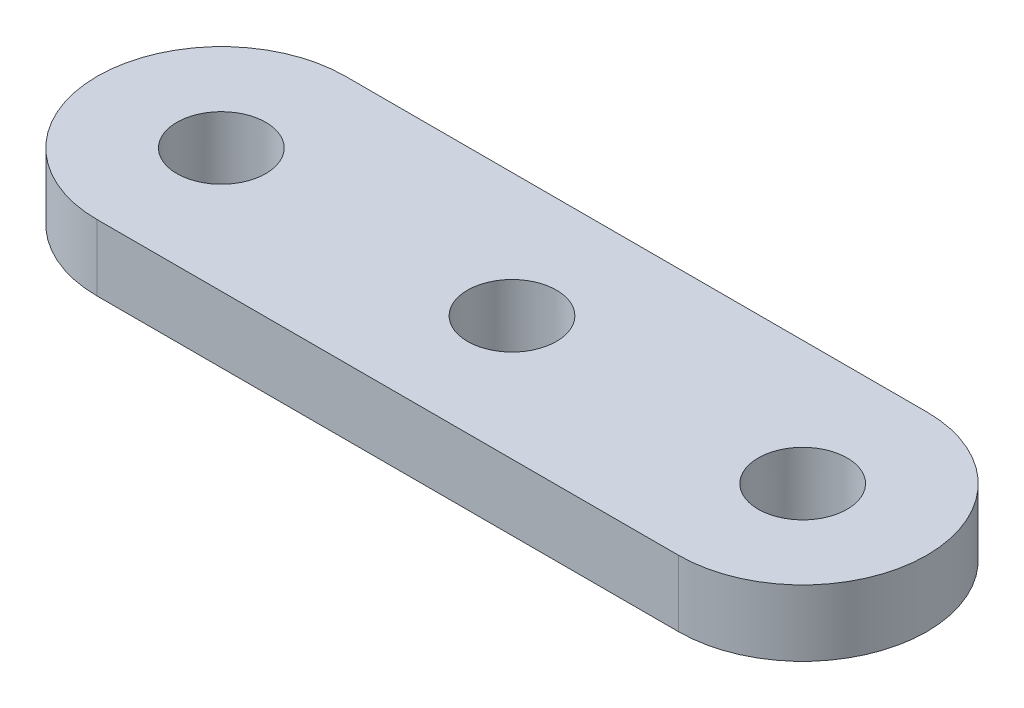
from build123d import *

# Parameters (mm, degrees)
BOSS_EXTRUDE2_DEPTH  = 3.2
M4_CLEARANCE_HOLE4_D = 4.3


with BuildPart() as part:
    # Sketch3 → Boss-Extrude2 (new body)
    with BuildSketch(Plane(origin=(0, 0, 0), x_dir=(1, 0, 0), z_dir=(0, 1, 0))):
        with BuildLine():
            Line((-14.05, 6), (14.05, 6))
            ThreePointArc((14.05, 6), (20.05, 0), (14.05, -6))
            Line((14.05, -6), (-14.05, -6))
            ThreePointArc((-14.05, -6), (-20.05, 0), (-14.05, 6))
        make_face()
    extrude(amount=BOSS_EXTRUDE2_DEPTH)

    # M4 Clearance Hole4 (through all)
    with Locations(Plane(origin=(0, 3.2, 0), x_dir=(1, 0, 0), z_dir=(0, 1, 0))):
        with Locations((0, 0), (14.05, 0), (-14.05, 0)):
            Hole(M4_CLEARANCE_HOLE4_D / 2)


solid = part.part
